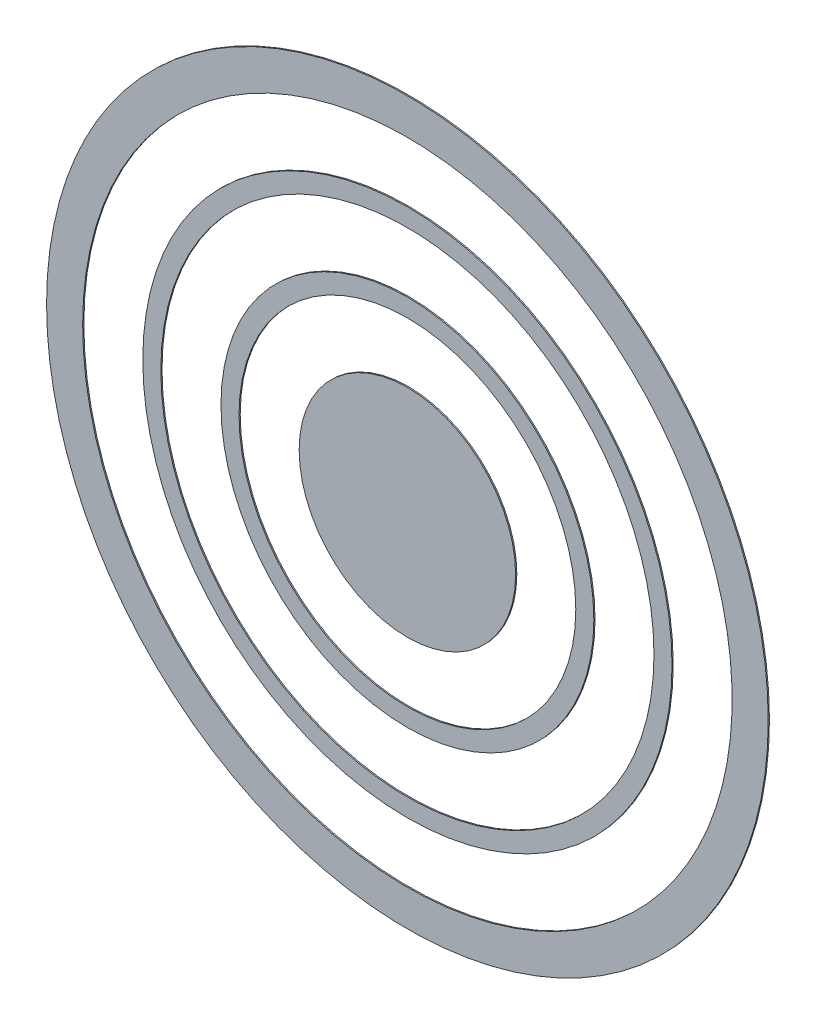
from build123d import *

# Parameters (mm, degrees)
SKETCH_1_R        = 3
SKETCH_1_R_2      = 2.7
EXTRUDE_1_DEPTH   = 0.01
SKETCH_1_R_3      = 2.2
SKETCH_1_R_4      = 2.05
EXTRUDE_1_2_DEPTH = 0.01
SKETCH_1_R_5      = 1.55
SKETCH_1_R_6      = 1.4
EXTRUDE_1_3_DEPTH = 0.01
SKETCH_1_R_7      = 0.9
EXTRUDE_1_4_DEPTH = 0.01


with BuildPart() as part:
    # Эскиз1 → Бобышка-Вытянуть1 (new body)
    with BuildSketch(Plane.XY):
        with Locations(Location((0, 0, 0), (0, 0, 180))):
            Circle(SKETCH_1_R)
        with Locations(Location((0, 0, 0), (0, 0, 180))):
            Circle(SKETCH_1_R_2, mode=Mode.SUBTRACT)
    extrude(amount=EXTRUDE_1_DEPTH)


with BuildPart() as body_2:
    # Эскиз1 → Extrude 1 2 (new body)
    with BuildSketch(Plane.XY):
        with Locations(Location((0, 0, 0), (0, 0, 180))):
            Circle(SKETCH_1_R_3)
        with Locations(Location((0, 0, 0), (0, 0, 180))):
            Circle(SKETCH_1_R_4, mode=Mode.SUBTRACT)
    extrude(amount=EXTRUDE_1_2_DEPTH)


with BuildPart() as body_3:
    # Эскиз1 → Extrude 1 3 (new body)
    with BuildSketch(Plane.XY):
        with Locations(Location((0, 0, 0), (0, 0, 180))):
            Circle(SKETCH_1_R_5)
        with Locations(Location((0, 0, 0), (0, 0, 180))):
            Circle(SKETCH_1_R_6, mode=Mode.SUBTRACT)
    extrude(amount=EXTRUDE_1_3_DEPTH)


with BuildPart() as body_4:
    # Эскиз1 → Extrude 1 4 (new body)
    with BuildSketch(Plane.XY):
        with Locations(Location((0, 0, 0), (0, 0, 180))):
            Circle(SKETCH_1_R_7)
    extrude(amount=EXTRUDE_1_4_DEPTH)


solid = Compound([part.part, body_2.part, body_3.part, body_4.part])
